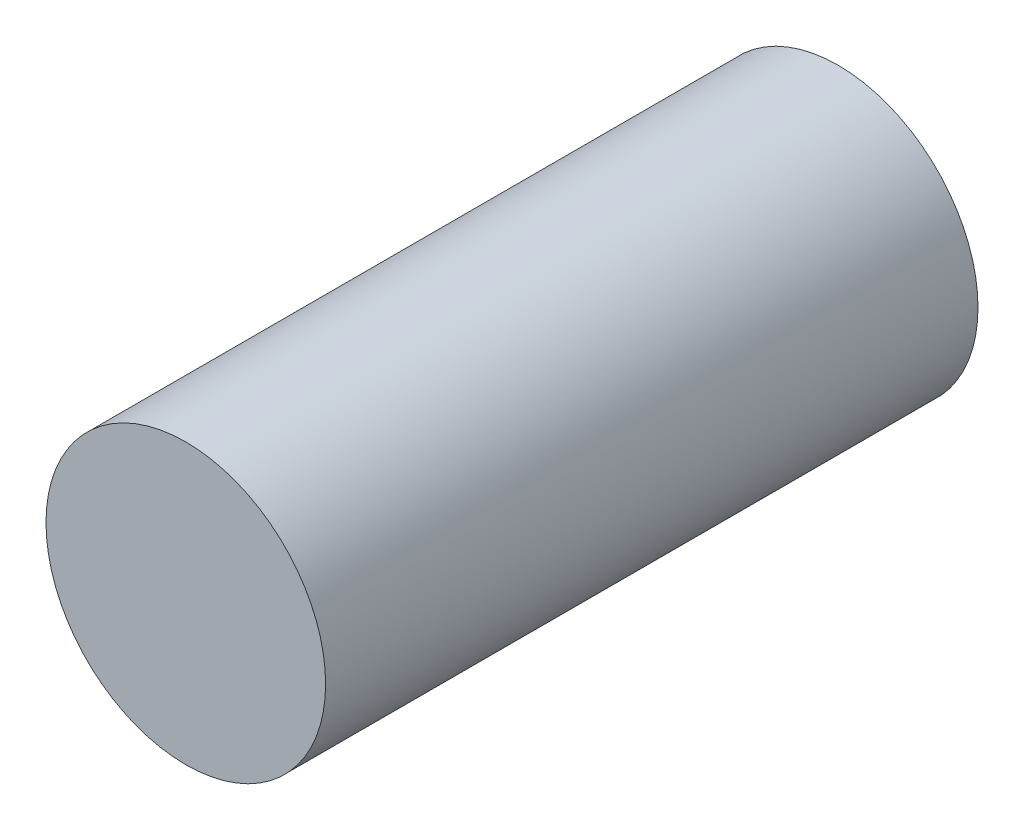
from build123d import *

# Parameters (mm, degrees)
ESQUISSE1_R        = 15
BOSS_EXTRU_1_DEPTH = 70


with BuildPart() as part:
    # Esquisse1 → Boss.-Extru.1 (new body)
    with BuildSketch(Plane.XY):
        Circle(ESQUISSE1_R)
    extrude(amount=BOSS_EXTRU_1_DEPTH)


solid = part.part
